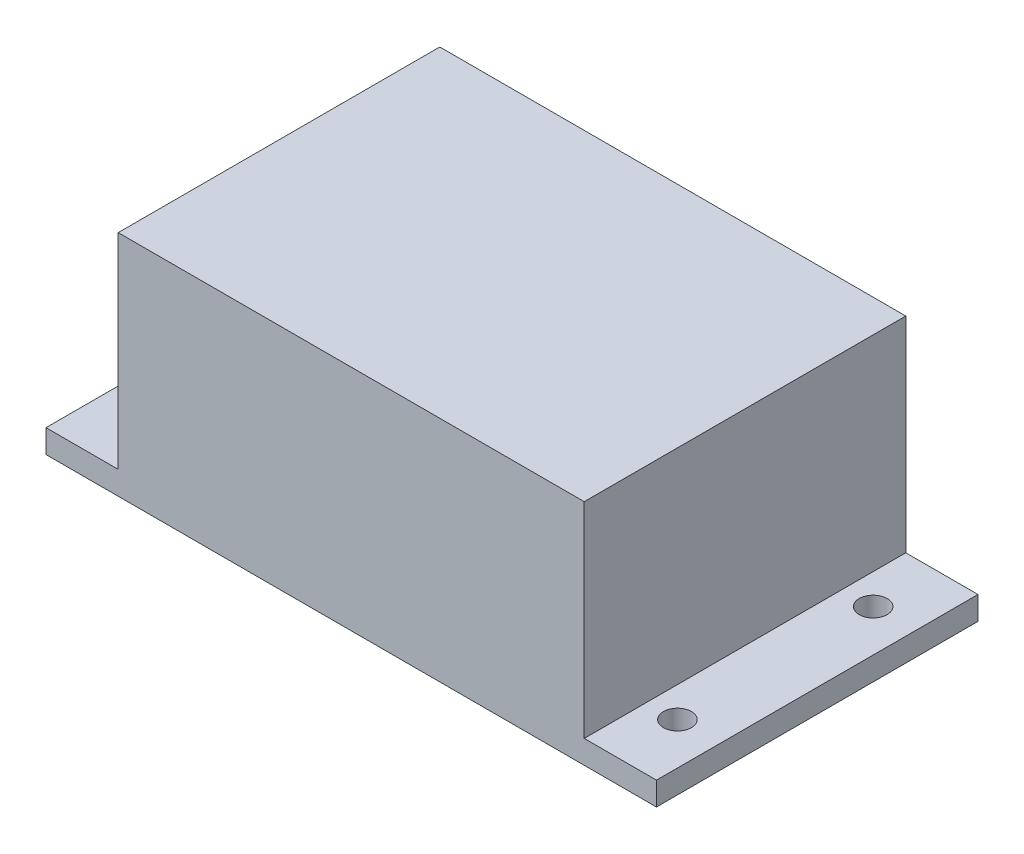
from build123d import *

# Parameters (mm, degrees)
SKETCH_1_W        = 15.5
SKETCH_1_H        = 69
SKETCH_1_R        = 3
EXTRUDE_1_DEPTH   = 5
EXTRUDE_1_2_DEPTH = 5
SKETCH_1_3_W      = 100
SKETCH_1_3_H      = 69
EXTRUDE_2_DEPTH   = 49


with BuildPart() as part:
    # 草图1 → 凸台-拉伸1 (new body)
    with BuildSketch(Plane(origin=(0, 0, 0), x_dir=(1, 0, 0), z_dir=(0, 1, 0))):
        with Locations((-57.75, 0)):
            Rectangle(SKETCH_1_W, SKETCH_1_H)
        with Locations((-56.5, -21)):
            Circle(SKETCH_1_R, mode=Mode.SUBTRACT)
        with Locations((-56.5, 21)):
            Circle(SKETCH_1_R, mode=Mode.SUBTRACT)
    extrude(amount=EXTRUDE_1_DEPTH)



with BuildPart() as body_2:
    # 草图1 → Extrude 1 2 (new body)
    with BuildSketch(Plane(origin=(0, 0, 0), x_dir=(1, 0, 0), z_dir=(0, 1, 0))):
        with Locations((57.75, 0)):
            Rectangle(SKETCH_1_W, SKETCH_1_H)
        with Locations((56.5, -21)):
            Circle(SKETCH_1_R, mode=Mode.SUBTRACT)
        with Locations((56.5, 21)):
            Circle(SKETCH_1_R, mode=Mode.SUBTRACT)
    extrude(amount=EXTRUDE_1_2_DEPTH)


with BuildPart() as part_1:
    add(part.part)

    add(body_2.part)  # 凸台-拉伸2 merges body 2
    # 草图1<3> → 凸台-拉伸2 (add)
    with BuildSketch(Plane(origin=(0, 0, 0), x_dir=(1, 0, 0), z_dir=(0, 1, 0))):
        Rectangle(SKETCH_1_3_W, SKETCH_1_3_H)
    extrude(amount=EXTRUDE_2_DEPTH)


solid = part_1.part
